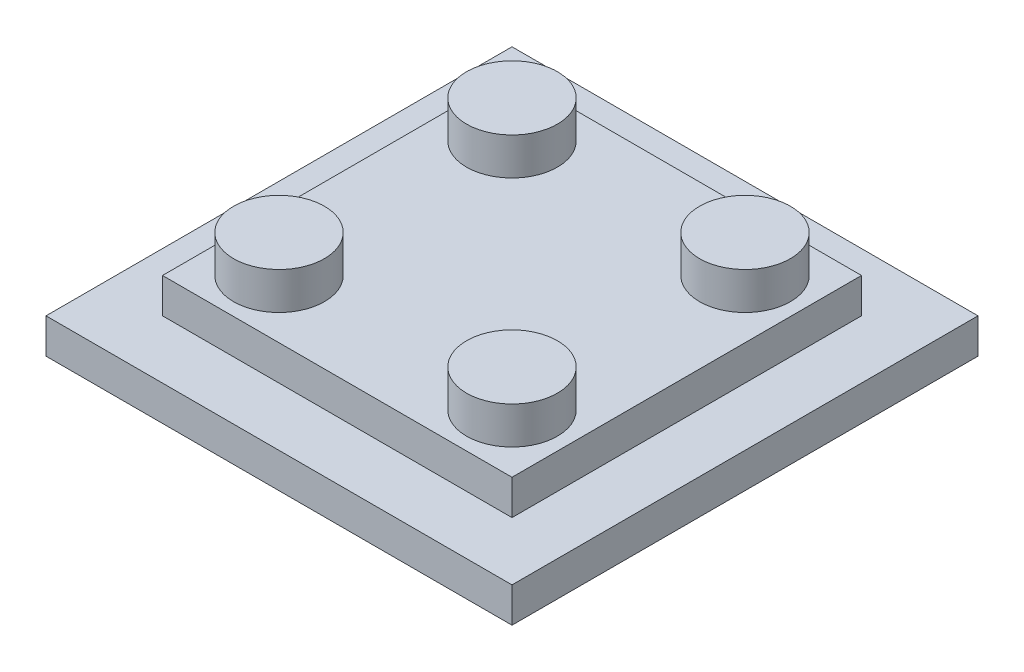
from build123d import *

# Parameters (mm, degrees)
SKETCH1_W           = 30
SKETCH1_H           = 30
SKETCH1_R           = 3.9
BOSS_EXTRUDE1_DEPTH = 3
SKETCH2_R           = 3.9
BOSS_EXTRUDE2_DEPTH = 3.2
SKETCH3_W           = 40
SKETCH3_H           = 40
BOSS_EXTRUDE3_DEPTH = 3


with BuildPart() as part:
    # Sketch1 → Boss-Extrude1 (new body)
    # profile 1 of 5: a face of its own
    with BuildSketch(Plane(origin=(0, 0, 0), x_dir=(1, 0, 0), z_dir=(0, 1, 0))):
        Rectangle(SKETCH1_W, SKETCH1_H)
        with Locations((10, -10)):
            Circle(SKETCH1_R, mode=Mode.SUBTRACT)
        with Locations((-10, -10)):
            Circle(SKETCH1_R, mode=Mode.SUBTRACT)
        with Locations((10, 10)):
            Circle(SKETCH1_R, mode=Mode.SUBTRACT)
        with Locations((-10, 10)):
            Circle(SKETCH1_R, mode=Mode.SUBTRACT)
    # profile 2 of 5: a face of its own
    with BuildSketch(Plane(origin=(0, 0, 0), x_dir=(1, 0, 0), z_dir=(0, 1, 0))):
        with Locations((-10, 10)):
            Circle(SKETCH1_R)
    # profile 3 of 5: a face of its own
    with BuildSketch(Plane(origin=(0, 0, 0), x_dir=(1, 0, 0), z_dir=(0, 1, 0))):
        with Locations((10, 10)):
            Circle(SKETCH1_R)
    # profile 4 of 5: a face of its own
    with BuildSketch(Plane(origin=(0, 0, 0), x_dir=(1, 0, 0), z_dir=(0, 1, 0))):
        with Locations((-10, -10)):
            Circle(SKETCH1_R)
    # profile 5 of 5: a face of its own
    with BuildSketch(Plane(origin=(0, 0, 0), x_dir=(1, 0, 0), z_dir=(0, 1, 0))):
        with Locations((10, -10)):
            Circle(SKETCH1_R)
    extrude(amount=BOSS_EXTRUDE1_DEPTH)

    # Sketch2 → Boss-Extrude2 (add)
    with BuildSketch(Plane(origin=(0, 3, 0), x_dir=(1, 0, 0), z_dir=(0, 1, 0))):
        with Locations(Location((-10, -10, 0), (0, 0, 270))):
            Circle(SKETCH2_R)
        with Locations(Location((10, -10, 0), (0, 0, 270))):
            Circle(SKETCH2_R)
        with Locations(Location((10, 10, 0), (0, 0, 270))):
            Circle(SKETCH2_R)
        with Locations(Location((-10, 10, 0), (0, 0, 270))):
            Circle(SKETCH2_R)
    extrude(amount=BOSS_EXTRUDE2_DEPTH)

    # Sketch3 → Boss-Extrude3 (add)
    with BuildSketch(Plane.XZ):
        Rectangle(SKETCH3_W, SKETCH3_H)
    extrude(amount=BOSS_EXTRUDE3_DEPTH)


solid = part.part
